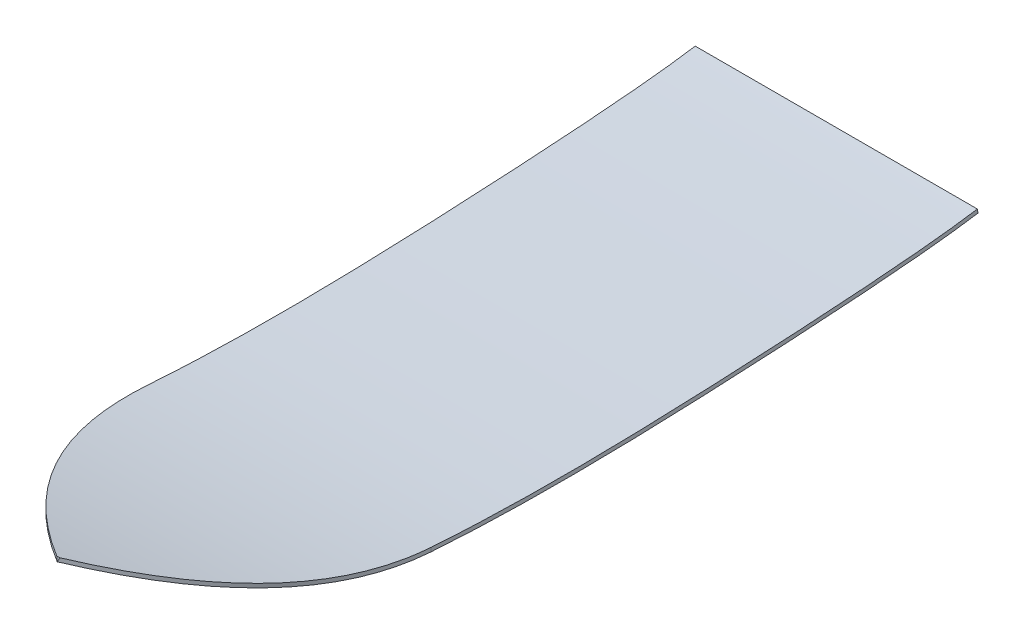
from build123d import *

# Parameters (mm, degrees)
BOSS_EXTRUDE1_DEPTH      = 1524
BOSS_EXTRUDE1_DEPTH_BACK = 1524
CUT_EXTRUDE1_DEPTH       = 2992.748420009
CUT_EXTRUDE1_DEPTH_BACK  = 2992.748420009
SKETCH3_W                = 5731.45735109
SKETCH3_H                = 8003.305882061


with BuildPart() as part:
    # Sketch1 → Boss-Extrude1 (new, two sides: drawn at the far end of the back side and taken through both)
    with BuildSketch(Plane(origin=(0, 0, 0), x_dir=(0, 0, -1), z_dir=(1, 0, 0)).offset(-BOSS_EXTRUDE1_DEPTH_BACK)):
        with BuildLine():
            Line((-2398.611377998, 165.245211029), (-2404.944681987, 141.060727148))
            add(Edge.make_bspline(
                [(-2404.944681987, 141.060727148), (-2392.438935922, 137.785788893), (-2367.39134852, 131.296344325), (-2317.380837799, 118.617543263), (-2254.915944732, 103.299735336), (-2180.055793431, 85.76309848), (-2080.343313645, 63.486670774), (-1955.866702261, 37.682706533), (-1806.655589196, 9.868844957), (-1657.506367449, -14.909501803), (-1458.584035118, -44.064747851), (-1209.56792904, -73.537716838), (-959.489995341, -94.572563957), (-758.22939272, -106.878460636), (-555.764194191, -116.354460133), (-300.029288106, -123.203514219), (12.864921871, -124.39148834), (280.042118201, -120.265440149), (498.52502341, -114.317535887), (664.986287882, -108.634485545), (834.276815116, -101.830793725), (977.921068614, -95.309665438), (1094.512274297, -89.631767138), (1212.102658182, -83.661862041), (1360.21397961, -75.655833239), (1537.460229326, -65.195622085), (1711.929815843, -53.900040927), (1881.338816591, -41.786466684), (2016.37818431, -31.024964931), (2119.581517256, -22.023943599), (2194.283967932, -15.079321512), (2266.001197469, -7.942721355), (2334.449271005, -0.615721824), (2388.529821525, 5.64782116), (2429.878742866, 10.753081218), (2459.898117511, 14.629304742), (2488.890722753, 18.552928257), (2512.16761131, 21.862389071), (2530.241452514, 24.533917167), (2543.520790162, 26.549931934), (2554.34694371, 28.239264993), (2562.876537382, 29.598767849), (2567.072284199, 30.277146752), (2569.178200905, 30.620130897)],
                knots=[0.003043622, 0.003043622, 0.003043622, 0.003043622, 0.010832344, 0.018621065, 0.034198509, 0.049775952, 0.065353395, 0.096508282, 0.127663169, 0.158818056, 0.189972943, 0.252282716, 0.31459249, 0.345747377, 0.376902264, 0.439212037, 0.501521811, 0.563831585, 0.594986471, 0.626141358, 0.657296245, 0.688451132, 0.704028575, 0.719606019, 0.750760905, 0.781915792, 0.813070679, 0.844225566, 0.875380453, 0.890957896, 0.90653534, 0.922112783, 0.937690226, 0.95326767, 0.961056391, 0.968845113, 0.976633835, 0.984422557, 0.988316917, 0.992211278, 0.996105639, 0.99805282, 1, 1, 1, 1], degree=3))
            Line((2569.178200905, 30.620130897), (2565.159478908, 55.295014352))
            add(Edge.make_bspline(
                [(-2398.611377998, 165.245211029), (-2303.367088734, 140.303143208), (-2108.582520189, 93.456520923), (-1814.996988062, 35.211793333), (-1516.807436734, -11.784032044), (-1239.788623782, -44.952656477), (-1055.413486582, -61.36380371), (-904.95123464, -72.744265743), (-782.389010613, -80.636149789), (-564.029826352, -91.045914054), (-308.159952707, -98.083727736), (4.977804688, -99.444306394), (325.933191717, -94.615714755), (656.480386948, -84.446819311), (902.279306253, -73.886002845), (1042.557335844, -67.129410576), (1071.815413067, -65.694964568), (1170.729148515, -60.806729416), (1384.269281506, -49.55400093), (1709.627076429, -29.582299212), (2155.787720428, 3.841952629), (2431.938069797, 33.597655243), (2565.159478908, 55.295014352)],
                knots=[0.003043622, 0.003043622, 0.003043622, 0.003043622, 0.0625, 0.125, 0.1875, 0.25, 0.298828125, 0.302734375, 0.34375, 0.375, 0.4375, 0.5, 0.5625, 0.625, 0.6875, 0.697265625, 0.700195312, 0.703125, 0.75, 0.8125, 0.875, 1, 1, 1, 1], degree=3))
        make_face()
    extrude(amount=BOSS_EXTRUDE1_DEPTH + BOSS_EXTRUDE1_DEPTH_BACK)

    # Sketch3 → Cut-Extrude1 (cut, two sides: drawn at the far end of the back side and taken through both)
    with BuildSketch(Plane(origin=(0, 0, 0), x_dir=(1, 0, 0), z_dir=(0, 1, 0)).offset(-CUT_EXTRUDE1_DEPTH_BACK)):
        with Locations((-68.47307406, 1370.374733043)):
            Rectangle(SKETCH3_W, SKETCH3_H)
        with BuildLine():
            Line((-900, 2596.414610675), (900, 2596.414610675))
            Line((900, 2596.414610675), (900, -921.119039877))
            add(Edge.make_bspline(
                [(900, -921.119039877), (900, -1795.75764506), (0, -2404.944681987)],
                knots=[0, 0, 0, 1, 1, 1], degree=2))
            add(Edge.make_bspline(
                [(-900, -921.119039877), (-900, -1795.75764506), (0, -2404.944681987)],
                knots=[0, 0, 0, 1, 1, 1], degree=2))
            Line((-900, -921.119039877), (-900, 2596.414610675))
        make_face(mode=Mode.SUBTRACT)
    extrude(amount=CUT_EXTRUDE1_DEPTH + CUT_EXTRUDE1_DEPTH_BACK, mode=Mode.SUBTRACT)


solid = part.part
